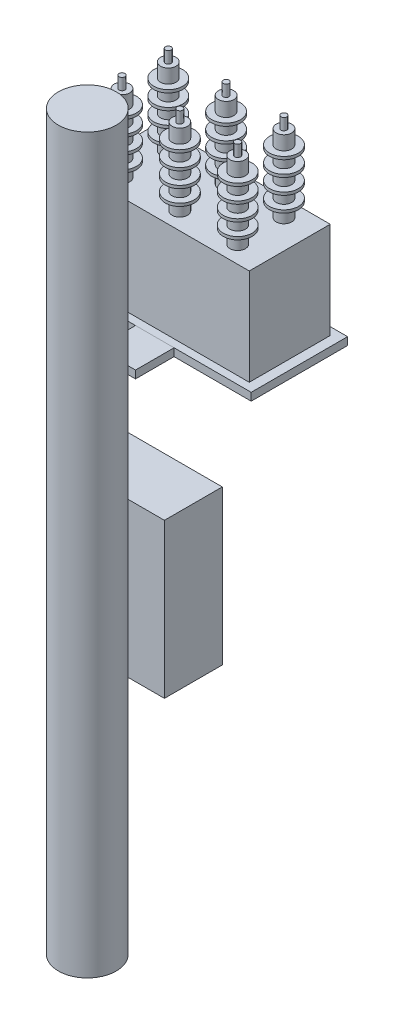
from build123d import *

# Parameters (mm, degrees)
SKETCH1_W               = 900
SKETCH1_H               = 420
TANK_DEPTH              = 500
FRAME_START             = -40
SKETCH2_W               = 1000
SKETCH2_H               = 500
FRAME_DEPTH             = 40
SKETCH3_W               = 200
SKETCH3_H               = 200
FRAME_ARM_DEPTH         = 40
CONTROL_START           = -1400
SKETCH4_W               = 500
SKETCH4_H               = 300
CONTROL_CABINET_DEPTH   = 800
POLE_START              = -2600
SKETCH5_R               = 150
POLE_DEPTH              = 3800
BUSHING_START           = 500
SKETCH6_R               = 40
BUSHING_SOURCE_A_DEPTH  = 400
SHED_START              = 572.5
SKETCH7_R               = 75
SHED_SOURCE_A_1_DEPTH   = 15
SHED_START_2            = 652.5
SKETCH8_R               = 75
SHED_SOURCE_A_2_DEPTH   = 15
SHED_START_3            = 732.5
SKETCH9_R               = 75
SHED_SOURCE_A_3_DEPTH   = 15
SHED_START_4            = 812.5
SKETCH10_R              = 75
SHED_SOURCE_A_4_DEPTH   = 15
TERMINAL_START          = 900
SKETCH11_R              = 15
TERMINAL_SOURCE_A_DEPTH = 60
SKETCH12_R              = 40
BUSHING_SOURCE_B_DEPTH  = 400
SKETCH13_R              = 75
SHED_SOURCE_B_1_DEPTH   = 15
SKETCH14_R              = 75
SHED_SOURCE_B_2_DEPTH   = 15
SKETCH15_R              = 75
SHED_SOURCE_B_3_DEPTH   = 15
SKETCH16_R              = 75
SHED_SOURCE_B_4_DEPTH   = 15
SKETCH17_R              = 15
TERMINAL_SOURCE_B_DEPTH = 60
SKETCH18_R              = 40
BUSHING_SOURCE_C_DEPTH  = 400
SKETCH19_R              = 75
SHED_SOURCE_C_1_DEPTH   = 15
SKETCH20_R              = 75
SHED_SOURCE_C_2_DEPTH   = 15
SKETCH21_R              = 75
SHED_SOURCE_C_3_DEPTH   = 15
SKETCH22_R              = 75
SHED_SOURCE_C_4_DEPTH   = 15
SKETCH23_R              = 15
TERMINAL_SOURCE_C_DEPTH = 60
SKETCH24_R              = 40
BUSHING_LOAD_A_DEPTH    = 400
SKETCH25_R              = 75
SHED_LOAD_A_1_DEPTH     = 15
SKETCH26_R              = 75
SHED_LOAD_A_2_DEPTH     = 15
SKETCH27_R              = 75
SHED_LOAD_A_3_DEPTH     = 15
SKETCH28_R              = 75
SHED_LOAD_A_4_DEPTH     = 15
SKETCH29_R              = 15
TERMINAL_LOAD_A_DEPTH   = 60
SKETCH30_R              = 40
BUSHING_LOAD_B_DEPTH    = 400
SKETCH31_R              = 75
SHED_LOAD_B_1_DEPTH     = 15
SKETCH32_R              = 75
SHED_LOAD_B_2_DEPTH     = 15
SKETCH33_R              = 75
SHED_LOAD_B_3_DEPTH     = 15
SKETCH34_R              = 75
SHED_LOAD_B_4_DEPTH     = 15
SKETCH35_R              = 15
TERMINAL_LOAD_B_DEPTH   = 60
SKETCH36_R              = 40
BUSHING_LOAD_C_DEPTH    = 400
SKETCH37_R              = 75
SHED_LOAD_C_1_DEPTH     = 15
SKETCH38_R              = 75
SHED_LOAD_C_2_DEPTH     = 15
SKETCH39_R              = 75
SHED_LOAD_C_3_DEPTH     = 15
SKETCH40_R              = 75
SHED_LOAD_C_4_DEPTH     = 15
SKETCH41_R              = 15
TERMINAL_LOAD_C_DEPTH   = 60


with BuildPart() as part:
    # Sketch1 → Tank (new body)
    with BuildSketch(Plane(origin=(0, 0, 0), x_dir=(1, 0, 0), z_dir=(0, 1, 0))):
        Rectangle(SKETCH1_W, SKETCH1_H)
    extrude(amount=TANK_DEPTH)


with BuildPart() as body_2:
    # Sketch2 → Frame (new body)
    with BuildSketch(Plane(origin=(0, 0, 0), x_dir=(1, 0, 0), z_dir=(0, 1, 0)).offset(FRAME_START)):
        Rectangle(SKETCH2_W, SKETCH2_H)
    extrude(amount=FRAME_DEPTH)


with BuildPart() as body_3:
    # Sketch3 → Frame arm (new body)
    with BuildSketch(Plane(origin=(0, 0, 0), x_dir=(1, 0, 0), z_dir=(0, 1, 0)).offset(FRAME_START)):
        with Locations((0, -350)):
            Rectangle(SKETCH3_W, SKETCH3_H)
    extrude(amount=FRAME_ARM_DEPTH)


with BuildPart() as body_4:
    # Sketch4 → Control cabinet (new body)
    with BuildSketch(Plane(origin=(0, 0, 0), x_dir=(1, 0, 0), z_dir=(0, 1, 0)).offset(CONTROL_START)):
        with Locations((0, -300)):
            Rectangle(SKETCH4_W, SKETCH4_H)
    extrude(amount=CONTROL_CABINET_DEPTH)


with BuildPart() as body_5:
    # Sketch5 → Pole (new body)
    with BuildSketch(Plane(origin=(0, 0, 0), x_dir=(1, 0, 0), z_dir=(0, 1, 0)).offset(POLE_START)):
        with Locations(Location((0, -600, 0), (0, 0, 90))):
            Circle(SKETCH5_R)
    extrude(amount=POLE_DEPTH)


with BuildPart() as body_6:
    # Sketch6 → Bushing Source A (new body)
    with BuildSketch(Plane(origin=(0, 0, 0), x_dir=(1, 0, 0), z_dir=(0, 1, 0)).offset(BUSHING_START)):
        with Locations(Location((-300, 120, 0), (0, 0, 270))):
            Circle(SKETCH6_R)
    extrude(amount=BUSHING_SOURCE_A_DEPTH)


with BuildPart() as body_7:
    # Sketch7 → Shed Source A 1 (new body)
    with BuildSketch(Plane(origin=(0, 0, 0), x_dir=(1, 0, 0), z_dir=(0, 1, 0)).offset(SHED_START)):
        with Locations(Location((-300, 120, 0), (0, 0, 270))):
            Circle(SKETCH7_R)
    extrude(amount=SHED_SOURCE_A_1_DEPTH)


with BuildPart() as body_8:
    # Sketch8 → Shed Source A 2 (new body)
    with BuildSketch(Plane(origin=(0, 0, 0), x_dir=(1, 0, 0), z_dir=(0, 1, 0)).offset(SHED_START_2)):
        with Locations(Location((-300, 120, 0), (0, 0, 270))):
            Circle(SKETCH8_R)
    extrude(amount=SHED_SOURCE_A_2_DEPTH)


with BuildPart() as body_9:
    # Sketch9 → Shed Source A 3 (new body)
    with BuildSketch(Plane(origin=(0, 0, 0), x_dir=(1, 0, 0), z_dir=(0, 1, 0)).offset(SHED_START_3)):
        with Locations(Location((-300, 120, 0), (0, 0, 270))):
            Circle(SKETCH9_R)
    extrude(amount=SHED_SOURCE_A_3_DEPTH)


with BuildPart() as body_10:
    # Sketch10 → Shed Source A 4 (new body)
    with BuildSketch(Plane(origin=(0, 0, 0), x_dir=(1, 0, 0), z_dir=(0, 1, 0)).offset(SHED_START_4)):
        with Locations(Location((-300, 120, 0), (0, 0, 270))):
            Circle(SKETCH10_R)
    extrude(amount=SHED_SOURCE_A_4_DEPTH)


with BuildPart() as body_11:
    # Sketch11 → Terminal Source A (new body)
    with BuildSketch(Plane(origin=(0, 0, 0), x_dir=(1, 0, 0), z_dir=(0, 1, 0)).offset(TERMINAL_START)):
        with Locations(Location((-300, 120, 0), (0, 0, 270))):
            Circle(SKETCH11_R)
    extrude(amount=TERMINAL_SOURCE_A_DEPTH)


with BuildPart() as body_12:
    # Sketch12 → Bushing Source B (new body)
    with BuildSketch(Plane(origin=(0, 0, 0), x_dir=(1, 0, 0), z_dir=(0, 1, 0)).offset(BUSHING_START)):
        with Locations(Location((0, 120, 0), (0, 0, 270))):
            Circle(SKETCH12_R)
    extrude(amount=BUSHING_SOURCE_B_DEPTH)


with BuildPart() as body_13:
    # Sketch13 → Shed Source B 1 (new body)
    with BuildSketch(Plane(origin=(0, 0, 0), x_dir=(1, 0, 0), z_dir=(0, 1, 0)).offset(SHED_START)):
        with Locations(Location((0, 120, 0), (0, 0, 270))):
            Circle(SKETCH13_R)
    extrude(amount=SHED_SOURCE_B_1_DEPTH)


with BuildPart() as body_14:
    # Sketch14 → Shed Source B 2 (new body)
    with BuildSketch(Plane(origin=(0, 0, 0), x_dir=(1, 0, 0), z_dir=(0, 1, 0)).offset(SHED_START_2)):
        with Locations(Location((0, 120, 0), (0, 0, 270))):
            Circle(SKETCH14_R)
    extrude(amount=SHED_SOURCE_B_2_DEPTH)


with BuildPart() as body_15:
    # Sketch15 → Shed Source B 3 (new body)
    with BuildSketch(Plane(origin=(0, 0, 0), x_dir=(1, 0, 0), z_dir=(0, 1, 0)).offset(SHED_START_3)):
        with Locations(Location((0, 120, 0), (0, 0, 270))):
            Circle(SKETCH15_R)
    extrude(amount=SHED_SOURCE_B_3_DEPTH)


with BuildPart() as body_16:
    # Sketch16 → Shed Source B 4 (new body)
    with BuildSketch(Plane(origin=(0, 0, 0), x_dir=(1, 0, 0), z_dir=(0, 1, 0)).offset(SHED_START_4)):
        with Locations(Location((0, 120, 0), (0, 0, 270))):
            Circle(SKETCH16_R)
    extrude(amount=SHED_SOURCE_B_4_DEPTH)


with BuildPart() as body_17:
    # Sketch17 → Terminal Source B (new body)
    with BuildSketch(Plane(origin=(0, 0, 0), x_dir=(1, 0, 0), z_dir=(0, 1, 0)).offset(TERMINAL_START)):
        with Locations(Location((0, 120, 0), (0, 0, 270))):
            Circle(SKETCH17_R)
    extrude(amount=TERMINAL_SOURCE_B_DEPTH)


with BuildPart() as body_18:
    # Sketch18 → Bushing Source C (new body)
    with BuildSketch(Plane(origin=(0, 0, 0), x_dir=(1, 0, 0), z_dir=(0, 1, 0)).offset(BUSHING_START)):
        with Locations(Location((300, 120, 0), (0, 0, 270))):
            Circle(SKETCH18_R)
    extrude(amount=BUSHING_SOURCE_C_DEPTH)


with BuildPart() as body_19:
    # Sketch19 → Shed Source C 1 (new body)
    with BuildSketch(Plane(origin=(0, 0, 0), x_dir=(1, 0, 0), z_dir=(0, 1, 0)).offset(SHED_START)):
        with Locations(Location((300, 120, 0), (0, 0, 270))):
            Circle(SKETCH19_R)
    extrude(amount=SHED_SOURCE_C_1_DEPTH)


with BuildPart() as body_20:
    # Sketch20 → Shed Source C 2 (new body)
    with BuildSketch(Plane(origin=(0, 0, 0), x_dir=(1, 0, 0), z_dir=(0, 1, 0)).offset(SHED_START_2)):
        with Locations(Location((300, 120, 0), (0, 0, 270))):
            Circle(SKETCH20_R)
    extrude(amount=SHED_SOURCE_C_2_DEPTH)


with BuildPart() as body_21:
    # Sketch21 → Shed Source C 3 (new body)
    with BuildSketch(Plane(origin=(0, 0, 0), x_dir=(1, 0, 0), z_dir=(0, 1, 0)).offset(SHED_START_3)):
        with Locations(Location((300, 120, 0), (0, 0, 270))):
            Circle(SKETCH21_R)
    extrude(amount=SHED_SOURCE_C_3_DEPTH)


with BuildPart() as body_22:
    # Sketch22 → Shed Source C 4 (new body)
    with BuildSketch(Plane(origin=(0, 0, 0), x_dir=(1, 0, 0), z_dir=(0, 1, 0)).offset(SHED_START_4)):
        with Locations(Location((300, 120, 0), (0, 0, 270))):
            Circle(SKETCH22_R)
    extrude(amount=SHED_SOURCE_C_4_DEPTH)


with BuildPart() as body_23:
    # Sketch23 → Terminal Source C (new body)
    with BuildSketch(Plane(origin=(0, 0, 0), x_dir=(1, 0, 0), z_dir=(0, 1, 0)).offset(TERMINAL_START)):
        with Locations(Location((300, 120, 0), (0, 0, 270))):
            Circle(SKETCH23_R)
    extrude(amount=TERMINAL_SOURCE_C_DEPTH)


with BuildPart() as body_24:
    # Sketch24 → Bushing Load A (new body)
    with BuildSketch(Plane(origin=(0, 0, 0), x_dir=(1, 0, 0), z_dir=(0, 1, 0)).offset(BUSHING_START)):
        with Locations(Location((-300, -120, 0), (0, 0, 270))):
            Circle(SKETCH24_R)
    extrude(amount=BUSHING_LOAD_A_DEPTH)


with BuildPart() as body_25:
    # Sketch25 → Shed Load A 1 (new body)
    with BuildSketch(Plane(origin=(0, 0, 0), x_dir=(1, 0, 0), z_dir=(0, 1, 0)).offset(SHED_START)):
        with Locations(Location((-300, -120, 0), (0, 0, 270))):
            Circle(SKETCH25_R)
    extrude(amount=SHED_LOAD_A_1_DEPTH)


with BuildPart() as body_26:
    # Sketch26 → Shed Load A 2 (new body)
    with BuildSketch(Plane(origin=(0, 0, 0), x_dir=(1, 0, 0), z_dir=(0, 1, 0)).offset(SHED_START_2)):
        with Locations(Location((-300, -120, 0), (0, 0, 270))):
            Circle(SKETCH26_R)
    extrude(amount=SHED_LOAD_A_2_DEPTH)


with BuildPart() as body_27:
    # Sketch27 → Shed Load A 3 (new body)
    with BuildSketch(Plane(origin=(0, 0, 0), x_dir=(1, 0, 0), z_dir=(0, 1, 0)).offset(SHED_START_3)):
        with Locations(Location((-300, -120, 0), (0, 0, 270))):
            Circle(SKETCH27_R)
    extrude(amount=SHED_LOAD_A_3_DEPTH)


with BuildPart() as body_28:
    # Sketch28 → Shed Load A 4 (new body)
    with BuildSketch(Plane(origin=(0, 0, 0), x_dir=(1, 0, 0), z_dir=(0, 1, 0)).offset(SHED_START_4)):
        with Locations(Location((-300, -120, 0), (0, 0, 270))):
            Circle(SKETCH28_R)
    extrude(amount=SHED_LOAD_A_4_DEPTH)


with BuildPart() as body_29:
    # Sketch29 → Terminal Load A (new body)
    with BuildSketch(Plane(origin=(0, 0, 0), x_dir=(1, 0, 0), z_dir=(0, 1, 0)).offset(TERMINAL_START)):
        with Locations(Location((-300, -120, 0), (0, 0, 270))):
            Circle(SKETCH29_R)
    extrude(amount=TERMINAL_LOAD_A_DEPTH)


with BuildPart() as body_30:
    # Sketch30 → Bushing Load B (new body)
    with BuildSketch(Plane(origin=(0, 0, 0), x_dir=(1, 0, 0), z_dir=(0, 1, 0)).offset(BUSHING_START)):
        with Locations(Location((0, -120, 0), (0, 0, 270))):
            Circle(SKETCH30_R)
    extrude(amount=BUSHING_LOAD_B_DEPTH)


with BuildPart() as body_31:
    # Sketch31 → Shed Load B 1 (new body)
    with BuildSketch(Plane(origin=(0, 0, 0), x_dir=(1, 0, 0), z_dir=(0, 1, 0)).offset(SHED_START)):
        with Locations(Location((0, -120, 0), (0, 0, 270))):
            Circle(SKETCH31_R)
    extrude(amount=SHED_LOAD_B_1_DEPTH)


with BuildPart() as body_32:
    # Sketch32 → Shed Load B 2 (new body)
    with BuildSketch(Plane(origin=(0, 0, 0), x_dir=(1, 0, 0), z_dir=(0, 1, 0)).offset(SHED_START_2)):
        with Locations(Location((0, -120, 0), (0, 0, 270))):
            Circle(SKETCH32_R)
    extrude(amount=SHED_LOAD_B_2_DEPTH)


with BuildPart() as body_33:
    # Sketch33 → Shed Load B 3 (new body)
    with BuildSketch(Plane(origin=(0, 0, 0), x_dir=(1, 0, 0), z_dir=(0, 1, 0)).offset(SHED_START_3)):
        with Locations(Location((0, -120, 0), (0, 0, 270))):
            Circle(SKETCH33_R)
    extrude(amount=SHED_LOAD_B_3_DEPTH)


with BuildPart() as body_34:
    # Sketch34 → Shed Load B 4 (new body)
    with BuildSketch(Plane(origin=(0, 0, 0), x_dir=(1, 0, 0), z_dir=(0, 1, 0)).offset(SHED_START_4)):
        with Locations(Location((0, -120, 0), (0, 0, 270))):
            Circle(SKETCH34_R)
    extrude(amount=SHED_LOAD_B_4_DEPTH)


with BuildPart() as body_35:
    # Sketch35 → Terminal Load B (new body)
    with BuildSketch(Plane(origin=(0, 0, 0), x_dir=(1, 0, 0), z_dir=(0, 1, 0)).offset(TERMINAL_START)):
        with Locations(Location((0, -120, 0), (0, 0, 270))):
            Circle(SKETCH35_R)
    extrude(amount=TERMINAL_LOAD_B_DEPTH)


with BuildPart() as body_36:
    # Sketch36 → Bushing Load C (new body)
    with BuildSketch(Plane(origin=(0, 0, 0), x_dir=(1, 0, 0), z_dir=(0, 1, 0)).offset(BUSHING_START)):
        with Locations(Location((300, -120, 0), (0, 0, 270))):
            Circle(SKETCH36_R)
    extrude(amount=BUSHING_LOAD_C_DEPTH)


with BuildPart() as body_37:
    # Sketch37 → Shed Load C 1 (new body)
    with BuildSketch(Plane(origin=(0, 0, 0), x_dir=(1, 0, 0), z_dir=(0, 1, 0)).offset(SHED_START)):
        with Locations(Location((300, -120, 0), (0, 0, 270))):
            Circle(SKETCH37_R)
    extrude(amount=SHED_LOAD_C_1_DEPTH)


with BuildPart() as body_38:
    # Sketch38 → Shed Load C 2 (new body)
    with BuildSketch(Plane(origin=(0, 0, 0), x_dir=(1, 0, 0), z_dir=(0, 1, 0)).offset(SHED_START_2)):
        with Locations(Location((300, -120, 0), (0, 0, 270))):
            Circle(SKETCH38_R)
    extrude(amount=SHED_LOAD_C_2_DEPTH)


with BuildPart() as body_39:
    # Sketch39 → Shed Load C 3 (new body)
    with BuildSketch(Plane(origin=(0, 0, 0), x_dir=(1, 0, 0), z_dir=(0, 1, 0)).offset(SHED_START_3)):
        with Locations(Location((300, -120, 0), (0, 0, 270))):
            Circle(SKETCH39_R)
    extrude(amount=SHED_LOAD_C_3_DEPTH)


with BuildPart() as body_40:
    # Sketch40 → Shed Load C 4 (new body)
    with BuildSketch(Plane(origin=(0, 0, 0), x_dir=(1, 0, 0), z_dir=(0, 1, 0)).offset(SHED_START_4)):
        with Locations(Location((300, -120, 0), (0, 0, 270))):
            Circle(SKETCH40_R)
    extrude(amount=SHED_LOAD_C_4_DEPTH)


with BuildPart() as body_41:
    # Sketch41 → Terminal Load C (new body)
    with BuildSketch(Plane(origin=(0, 0, 0), x_dir=(1, 0, 0), z_dir=(0, 1, 0)).offset(TERMINAL_START)):
        with Locations(Location((300, -120, 0), (0, 0, 270))):
            Circle(SKETCH41_R)
    extrude(amount=TERMINAL_LOAD_C_DEPTH)


solid = Compound([part.part, body_2.part, body_3.part, body_4.part, body_5.part, body_6.part, body_7.part, body_8.part, body_9.part, body_10.part, body_11.part, body_12.part, body_13.part, body_14.part, body_15.part, body_16.part, body_17.part, body_18.part, body_19.part, body_20.part, body_21.part, body_22.part, body_23.part, body_24.part, body_25.part, body_26.part, body_27.part, body_28.part, body_29.part, body_30.part, body_31.part, body_32.part, body_33.part, body_34.part, body_35.part, body_36.part, body_37.part, body_38.part, body_39.part, body_40.part, body_41.part])
